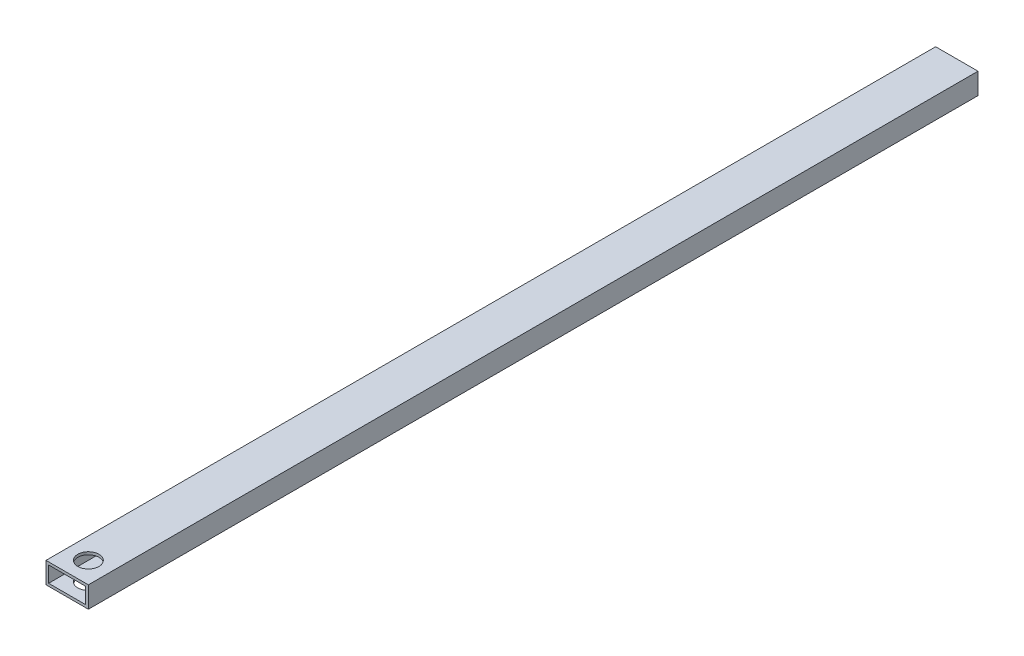
from build123d import *

# Parameters (mm, degrees)
SKETCH1_W               = 50.8
SKETCH1_H               = 25.4
BOSS_EXTRUDE2_DEPTH     = 1066.8
CUT_EXTRUDE2_DEPTH      = 1069.310834917
CUT_EXTRUDE2_DEPTH_BACK = 1069.310834917
SKETCH3_W               = 44.45
SKETCH3_H               = 19.05
CUT_EXTRUDE3_DEPTH      = 1069.310834917
CUT_EXTRUDE3_DEPTH_BACK = 1069.310834917
SKETCH4_R               = 12.7


with BuildPart() as part:
    # Sketch1 → Boss-Extrude2 (new body)
    with BuildSketch(Plane.XY):
        with Locations((25.4, 12.7)):
            Rectangle(SKETCH1_W, SKETCH1_H)
    extrude(amount=BOSS_EXTRUDE2_DEPTH)

    # Sketch3 → Cut-Extrude2 (cut, two sides: drawn at the far end of the back side and taken through both)
    with BuildSketch(Plane.XY.offset(1066.8).offset(-CUT_EXTRUDE2_DEPTH_BACK)):
        with Locations((25.4, 12.7)):
            Rectangle(SKETCH3_W, SKETCH3_H)
    extrude(amount=CUT_EXTRUDE2_DEPTH + CUT_EXTRUDE2_DEPTH_BACK, mode=Mode.SUBTRACT)

    # Sketch4 → Cut-Extrude3 (cut, two sides: drawn at the far end of the back side and taken through both)
    with BuildSketch(Plane(origin=(0, 25.4, 0), x_dir=(1, 0, 0), z_dir=(0, 1, 0)).offset(-CUT_EXTRUDE3_DEPTH_BACK)):
        with Locations(Location((25.4, -1041.4, 0), (0, 0, 270))):
            Circle(SKETCH4_R)
    extrude(amount=CUT_EXTRUDE3_DEPTH + CUT_EXTRUDE3_DEPTH_BACK, mode=Mode.SUBTRACT)


solid = part.part
